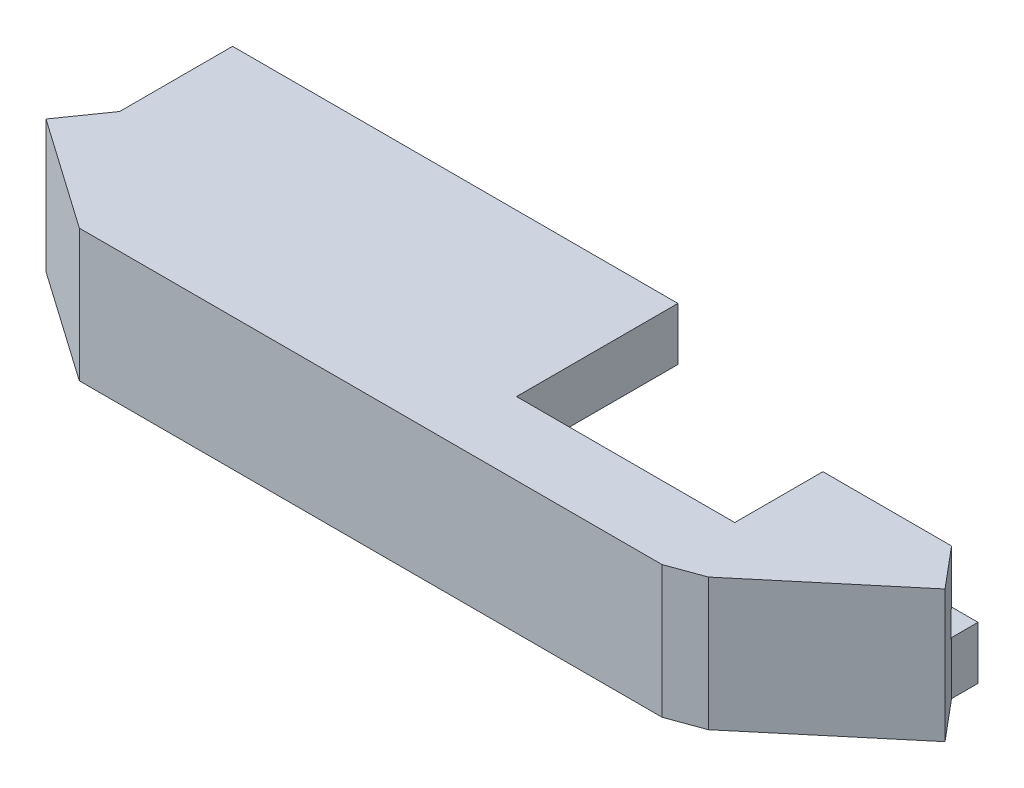
from build123d import *

# Parameters (mm, degrees)
BOSS_EXTRUDE1_DEPTH = 4
BOSS_EXTRUDE3_DEPTH = 2
BOSS_EXTRUDE4_DEPTH = 4
CUT_EXTRUDE1_DEPTH  = 4
BOSS_EXTRUDE6_START = -4
BOSS_EXTRUDE6_DEPTH = 4


with BuildPart() as part:
    # Sketch2 → Boss-Extrude1 (new body)
    with BuildSketch(Plane(origin=(0, 0, 0), x_dir=(1, 0, 0), z_dir=(0, 1, 0))):
        Polygon((-7.372368399, 13.7), (-7.372368399, 5.162187927), (-9.666674144, 1.88557975), (-1.261195156, -4), (42.8, -4), (45.371150439, -3.064177772), (55.099914866, 5.099224871), (52.528764428, 8.163402643), (42.8, 8.163402643), (42.8, 1.5), (26.3, 1.5), (26.3, 13.7), align=None)
    extrude(amount=BOSS_EXTRUDE1_DEPTH)

    # Sketch2<4> → Boss-Extrude3 (add)
    with BuildSketch(Plane(origin=(0, 0, 0), x_dir=(1, 0, 0), z_dir=(0, 1, 0))):
        with BuildLine():
            Line((-0.094589637, -0.3), (-7.54444133, 4.916442314))
            Line((-7.54444133, 4.916442314), (-9.666674144, 1.88557975))
            Line((-9.666674144, 1.88557975), (-1.261195156, -4))
            Line((-1.261195156, -4), (42.8, -4))
            Line((42.8, -4), (45.371150439, -3.064177772))
            Line((45.371150439, -3.064177772), (55.099914866, 5.099224871))
            Line((55.099914866, 5.099224871), (52.721600711, 7.93358931))
            Line((52.721600711, 7.93358931), (42.992836283, -0.229813333))
            Line((42.992836283, -0.229813333), (42.8, -0.3))
            Line((42.8, -0.3), (18.05881591, -0.3))
            Line((18.05881591, -0.3), (18.05881591, 0.607570661))
            ThreePointArc((18.05881591, 0.607570661), (13.15, 4.2), (8.24118409, 0.607570661))
            Line((8.24118409, 0.607570661), (8.24118409, -0.3))
            Line((8.24118409, -0.3), (-0.094589637, -0.3))
        make_face()
    extrude(amount=-BOSS_EXTRUDE3_DEPTH)

    # Sketch3 → Boss-Extrude4 (add)
    with BuildSketch(Plane(origin=(0, -2, 0), x_dir=(-1, 0, 0), z_dir=(0, -1, 0))):
        Polygon((-42.8, 0), (-44.028764428, 1.031055778), (-44.028764428, 10.163402643), (-52.528764428, 10.163402643), (-52.528764428, 8.163402643), (-55.099914866, 5.099224871), (-45.371150439, -3.064177772), (-42.8, -4), (1.261195156, -4), (9.666674144, 1.88557975), (7.372368399, 5.162187927), (-18.25881591, 5.162187927), (-18.25881591, 0), align=None)
    extrude(amount=BOSS_EXTRUDE4_DEPTH)

    # Sketch4 → Cut-Extrude1 (cut)
    with BuildSketch(Plane(origin=(0, -6, 0), x_dir=(-1, 0, 0), z_dir=(0, -1, 0))):
        Polygon((-18.25881591, 0), (-12.25881591, 0), (-12.25881591, 5.162187927), (-18.25881591, 5.190707464), align=None)
    extrude(amount=-CUT_EXTRUDE1_DEPTH, mode=Mode.SUBTRACT)

    # Sketch5 → Boss-Extrude6 (add)
    with BuildSketch(Plane(origin=(0, -6, 0), x_dir=(-1, 0, 0), z_dir=(0, -1, 0)).offset(BOSS_EXTRUDE6_START)):
        with BuildLine():
            Line((-18.05881591, 0), (-18.05881591, 0.607570661))
            ThreePointArc((-18.05881591, 0.607570661), (-15.819022848, 3.454408818), (-12.25881591, 4.122306272))
            Line((-12.25881591, 4.122306272), (-12.25881591, 0))
            Line((-12.25881591, 0), (-18.05881591, 0))
        make_face()
    extrude(amount=BOSS_EXTRUDE6_DEPTH)


solid = part.part
